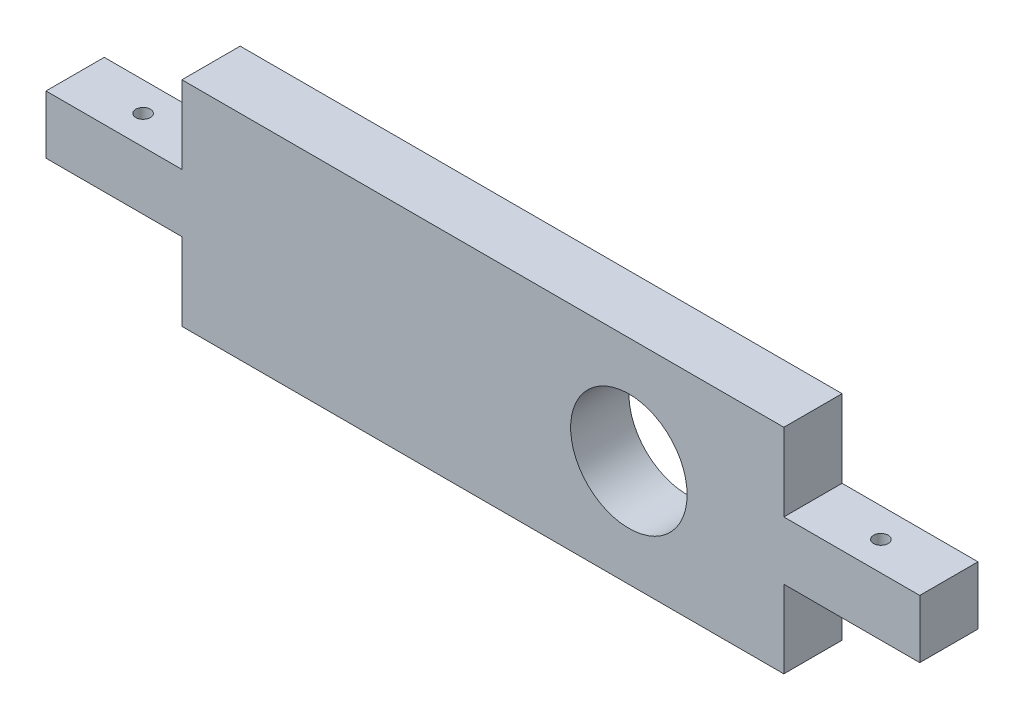
from build123d import *

# Parameters (mm, degrees)
SKETCH2_W           = 571.5
SKETCH2_H           = 139.7
BOSS_EXTRUDE2_DEPTH = 38.1
SKETCH3_W           = 88.9
SKETCH3_H           = 50.8
CUT_EXTRUDE1_DEPTH  = 590.559114933
SKETCH4_R           = 38.1
CUT_EXTRUDE2_DEPTH  = 590.559114933
SKETCH5_R           = 4.7625
CUT_EXTRUDE3_DEPTH  = 580.626664328
SKETCH6_R           = 4.7625
CUT_EXTRUDE4_DEPTH  = 580.626664328


with BuildPart() as part:
    # Sketch2 → Boss-Extrude2 (new body)
    with BuildSketch(Plane.XY):
        with Locations((285.75, 69.85)):
            Rectangle(SKETCH2_W, SKETCH2_H)
    extrude(amount=BOSS_EXTRUDE2_DEPTH)

    # Sketch3 → Cut-Extrude1 (cut, through all)
    with BuildSketch(Plane.XY.offset(38.1)):
        with Locations((44.45, 114.3)):
            Rectangle(SKETCH3_W, SKETCH3_H)
        with Locations((527.05, 114.3)):
            Rectangle(SKETCH3_W, SKETCH3_H)
        with Locations((527.05, 25.4)):
            Rectangle(SKETCH3_W, SKETCH3_H)
        with Locations((44.45, 25.4)):
            Rectangle(SKETCH3_W, SKETCH3_H)
    extrude(amount=-CUT_EXTRUDE1_DEPTH, mode=Mode.SUBTRACT)

    # Sketch4 → Cut-Extrude2 (cut, through all)
    with BuildSketch(Plane.XY.offset(38.1)):
        with Locations((381.247583626, 69.85)):
            Circle(SKETCH4_R)
    extrude(amount=-CUT_EXTRUDE2_DEPTH, mode=Mode.SUBTRACT)

    # Sketch5 → Cut-Extrude3 (cut, through all)
    with BuildSketch(Plane(origin=(0, 50.8, 0), x_dir=(-1, 0, 0), z_dir=(0, -1, 0))):
        with Locations(Location((-44.45, -19.05, 0), (0, 0, 180))):
            Circle(SKETCH5_R)
    extrude(amount=-CUT_EXTRUDE3_DEPTH, mode=Mode.SUBTRACT)

    # Sketch6 → Cut-Extrude4 (cut, through all)
    with BuildSketch(Plane.XZ.offset(-50.8)):
        with Locations((527.05, 19.05)):
            Circle(SKETCH6_R)
    extrude(amount=-CUT_EXTRUDE4_DEPTH, mode=Mode.SUBTRACT)


solid = part.part
